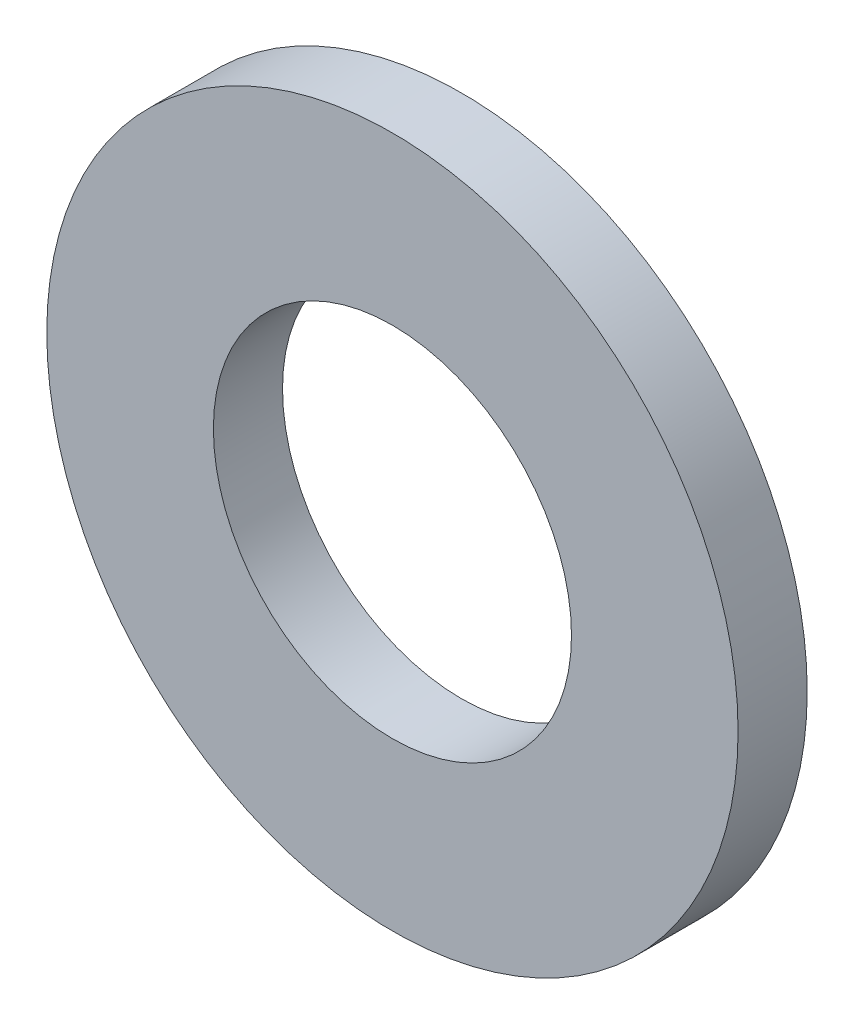
from build123d import *

# Parameters (mm, degrees)
SKETCH1_R          = 5
SKETCH1_R_2        = 2.59
BASE_EXTRUDE_DEPTH = 1


with BuildPart() as part:
    # Sketch1 → Base-Extrude (new body)
    with BuildSketch(Plane.XY):
        Circle(SKETCH1_R)
        Circle(SKETCH1_R_2, mode=Mode.SUBTRACT)
    extrude(amount=-BASE_EXTRUDE_DEPTH)


solid = part.part
